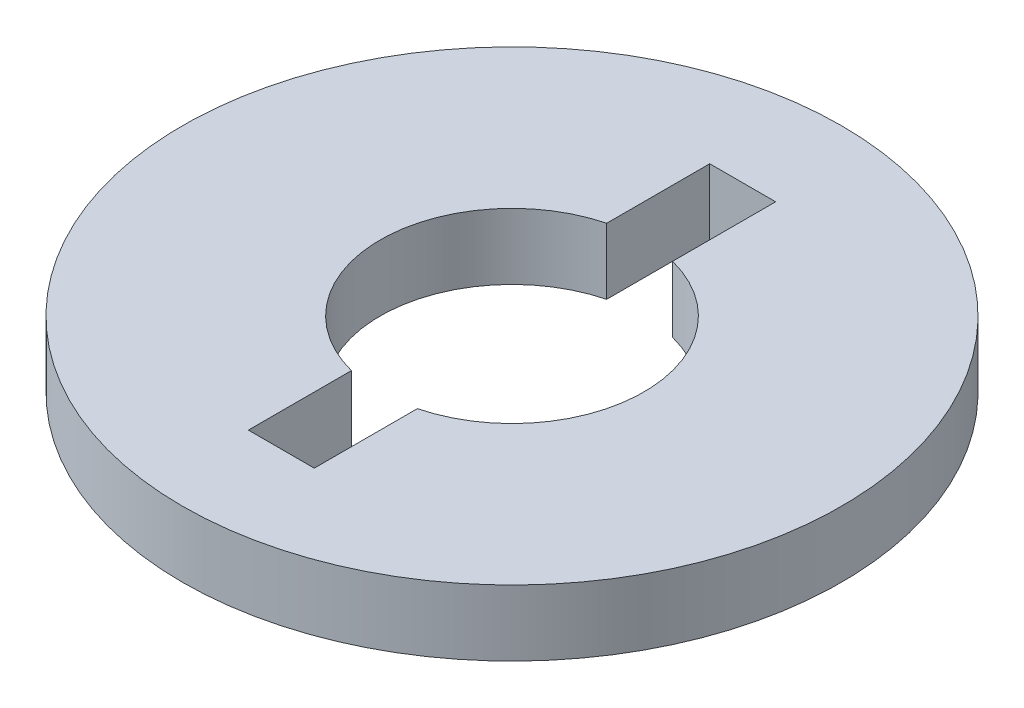
from build123d import *

# Parameters (mm, degrees)
SKETCH1_R           = 5
BOSS_EXTRUDE1_DEPTH = 1


with BuildPart() as part:
    # Sketch1 → Boss-Extrude1 (new body)
    with BuildSketch(Plane(origin=(0, 0, 0), x_dir=(1, 0, 0), z_dir=(0, 1, 0))):
        with Locations(Location((0, 0, 0), (0, 0, 270))):
            Circle(SKETCH1_R)
        with BuildLine():
            Line((0.5, 1.936491673), (0.5, 3.5))
            Line((0.5, 3.5), (-0.5, 3.5))
            Line((-0.5, 3.5), (-0.5, 1.936491673))
            ThreePointArc((-0.5, 1.936491673), (-2, 0), (-0.5, -1.936491673))
            Line((-0.5, -1.936491673), (-0.5, -3.5))
            Line((-0.5, -3.5), (0.5, -3.5))
            Line((0.5, -3.5), (0.5, -1.936491673))
            ThreePointArc((0.5, -1.936491673), (2, 0), (0.5, 1.936491673))
        make_face(mode=Mode.SUBTRACT)
    extrude(amount=BOSS_EXTRUDE1_DEPTH)


solid = part.part
